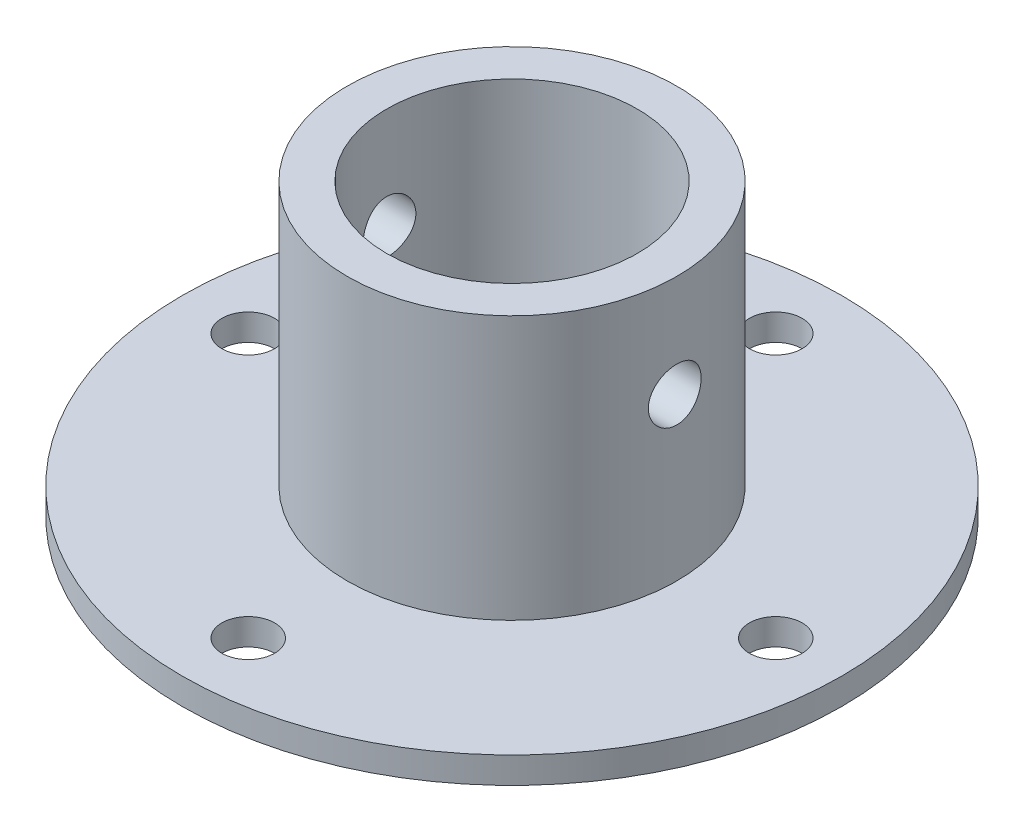
from build123d import *

# Parameters (mm, degrees)
SKETCH1_R               = 25
SKETCH1_R_2             = 9.5
BOSS_EXTRUDE1_DEPTH     = 2
SKETCH2_R               = 12.5
SKETCH2_R_2             = 9.5
BOSS_EXTRUDE2_DEPTH     = 20
SKETCH3_R               = 2
CUT_EXTRUDE1_DEPTH      = 25
CIRPATTERN1_COUNT       = 4
CUT_EXTRUDE2_DEPTH      = 42.641325627
CUT_EXTRUDE2_DEPTH_BACK = 42.641325627
SKETCH4_R               = 2


with BuildPart() as part:
    # Sketch1 → Boss-Extrude1 (new body)
    with BuildSketch(Plane(origin=(0, 0, 0), x_dir=(1, 0, 0), z_dir=(0, 1, 0))):
        with Locations(Location((0, 0, 0), (0, 0, 270))):
            Circle(SKETCH1_R)
        with Locations(Location((0, 0, 0), (0, 0, 270))):
            Circle(SKETCH1_R_2, mode=Mode.SUBTRACT)
    extrude(amount=BOSS_EXTRUDE1_DEPTH)

    # Sketch2 → Boss-Extrude2 (add)
    with BuildSketch(Plane(origin=(0, 2, 0), x_dir=(1, 0, 0), z_dir=(0, 1, 0))):
        with Locations(Location((0, 0, 0), (0, 0, 270))):
            Circle(SKETCH2_R)
        with Locations(Location((0, 0, 0), (0, 0, 270))):
            Circle(SKETCH2_R_2, mode=Mode.SUBTRACT)
    extrude(amount=BOSS_EXTRUDE2_DEPTH)

    # Sketch3 → Cut-Extrude1 (cut)
    with BuildSketch(Plane(origin=(0, 2, 0), x_dir=(1, 0, 0), z_dir=(0, 1, 0))):
        with Locations(Location((0, 20, 0), (0, 0, 270))):
            Circle(SKETCH3_R)
    cut_extrude1 = extrude(amount=-CUT_EXTRUDE1_DEPTH, mode=Mode.SUBTRACT)

    # CirPattern1: Cut-Extrude1 ×4 about axis
    cirpattern1_axis = Axis((0, 0, 0), (0, 1, 0))
    for i in range(1, CIRPATTERN1_COUNT):
        add(cut_extrude1.rotate(cirpattern1_axis, i * 360 / CIRPATTERN1_COUNT), mode=Mode.SUBTRACT)

    # Sketch4 → Cut-Extrude2 (cut, two sides: drawn at the far end of the back side and taken through both)
    with BuildSketch(Plane(origin=(0, 0, 0), x_dir=(0, 0, -1), z_dir=(1, 0, 0)).offset(-CUT_EXTRUDE2_DEPTH_BACK)):
        with Locations((0, 14.24552707)):
            Circle(SKETCH4_R)
    extrude(amount=CUT_EXTRUDE2_DEPTH + CUT_EXTRUDE2_DEPTH_BACK, mode=Mode.SUBTRACT)


solid = part.part
